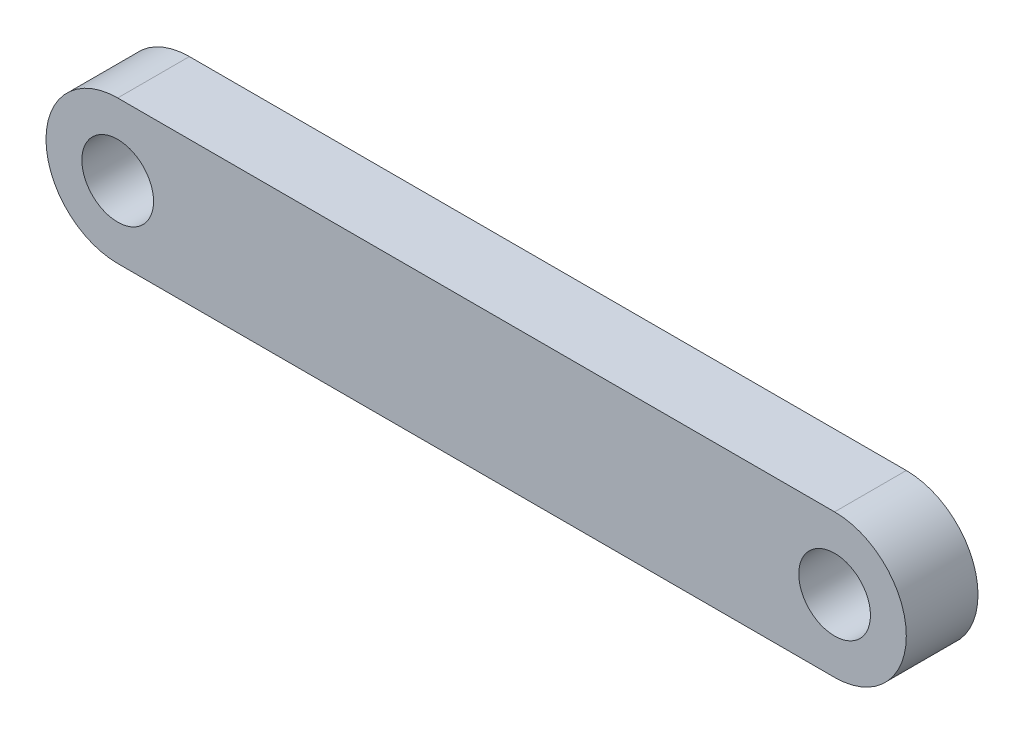
from build123d import *

# Parameters (mm, degrees)
SKETCH_1_R      = 1.5
EXTRUDE_1_DEPTH = 3


with BuildPart() as part:
    # 草图1 → 凸台-拉伸1 (new body)
    with BuildSketch(Plane.XY):
        with BuildLine():
            Line((-15, 3), (15, 3))
            ThreePointArc((15, 3), (18, 0), (15, -3))
            Line((15, -3), (-15, -3))
            ThreePointArc((-15, -3), (-18, 0), (-15, 3))
        make_face()
        with Locations((15, 0)):
            Circle(SKETCH_1_R, mode=Mode.SUBTRACT)
        with Locations((-15, 0)):
            Circle(SKETCH_1_R, mode=Mode.SUBTRACT)
    extrude(amount=EXTRUDE_1_DEPTH)


solid = part.part
